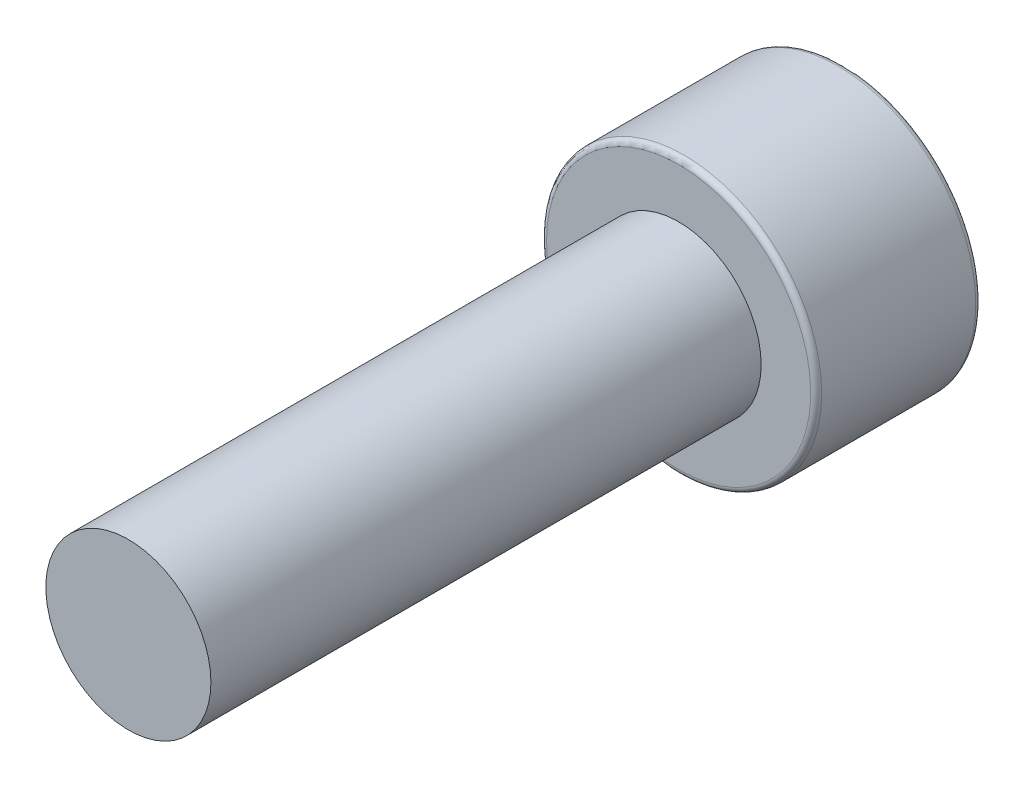
from build123d import *

# Parameters (mm, degrees)
CROQUIS1_R              = 1.5
SALIENTE_EXTRUIR1_DEPTH = 10
CROQUIS3_R              = 2.5
SALIENTE_EXTRUIR3_DEPTH = 3
CORTAR_EXTRUIR1_DEPTH   = 2.5
REDONDEO4_R             = 0.1
REDONDEO5_R             = 0.1


with BuildPart() as part:
    # Croquis1 → Saliente-Extruir1 (new body)
    with BuildSketch(Plane.XY):
        Circle(CROQUIS1_R)
    extrude(amount=SALIENTE_EXTRUIR1_DEPTH)

    # Croquis3 → Saliente-Extruir3 (add)
    with BuildSketch(Plane(origin=(0, 0, 0), x_dir=(-1, 0, 0), z_dir=(0, 0, -1))):
        Circle(CROQUIS3_R)
    extrude(amount=SALIENTE_EXTRUIR3_DEPTH)

    # Croquis4 → Cortar-Extruir1 (cut)
    with BuildSketch(Plane(origin=(0, 0, -3), x_dir=(-1, 0, 0), z_dir=(0, 0, -1))):
        Polygon((1.5, 0), (0.75, 1.299038106), (-0.75, 1.299038106), (-1.5, 0), (-0.75, -1.299038106), (0.75, -1.299038106), align=None)
    extrude(amount=-CORTAR_EXTRUIR1_DEPTH, mode=Mode.SUBTRACT)

    # Redondeo4
    redondeo4_edges = [part.edges().sort_by_distance(p)[0] for p in [
        (2.5, 0, -3),
    ]]
    fillet(redondeo4_edges, radius=REDONDEO4_R)

    # Redondeo5
    redondeo5_edges = [part.edges().sort_by_distance(p)[0] for p in [
        (2.5, 0, 0),
    ]]
    fillet(redondeo5_edges, radius=REDONDEO5_R)


solid = part.part
